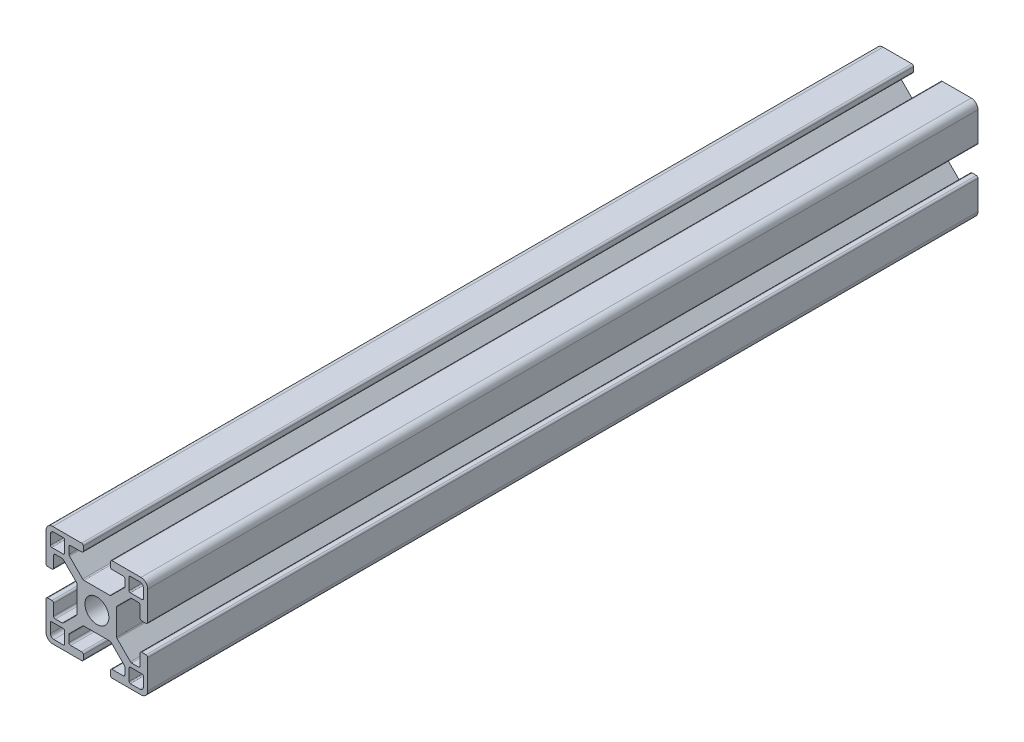
from build123d import *

# Parameters (mm, degrees)
SKETCH1_R           = 3.52998588
BOSS_EXTRUDE1_DEPTH = 122.396160471


with BuildPart() as part:
    # Sketch1 → Boss-Extrude1 (new, symmetric)
    with BuildSketch(Plane.XY):
        with BuildLine():
            Line((14.49994, -4), (13.24247465, -4))
            ThreePointArc((13.24247465, -4), (12.88892126, -4.146446609), (12.74247465, -4.5))
            Line((12.74247465, -4.5), (12.74247465, -7.732519321))
            ThreePointArc((12.74247465, -7.732519321), (12.602449697, -8.097296796), (12.242781236, -8.249967))
            Line((12.242781236, -8.249967), (10.260188032, -8.249967))
            ThreePointArc((10.260188032, -8.249967), (10.068847082, -8.211906919), (9.906636056, -8.103520976))
            Line((9.906636056, -8.103520976), (5.981117769, -4.178002689))
            ThreePointArc((5.981117769, -4.178002689), (5.872731827, -4.015791664), (5.834671745, -3.824450713))
            Line((5.834671745, -3.824450713), (5.834671745, -1.01249595))
            Line((5.834671745, -1.01249595), (5.834671745, 0.88749645))
            Line((5.834671745, 0.88749645), (5.834671745, 3.824450713))
            ThreePointArc((5.834671745, 3.824450713), (5.872731827, 4.015791664), (5.981117769, 4.178002689))
            Line((5.981117769, 4.178002689), (9.906636056, 8.103520976))
            ThreePointArc((9.906636056, 8.103520976), (10.068847082, 8.211906919), (10.260188032, 8.249967))
            Line((10.260188032, 8.249967), (12.242781236, 8.249967))
            ThreePointArc((12.242781236, 8.249967), (12.602449697, 8.097296796), (12.74247465, 7.732519321))
            Line((12.74247465, 7.732519321), (12.74247465, 4.5))
            ThreePointArc((12.74247465, 4.5), (12.88892126, 4.146446609), (13.24247465, 4))
            Line((13.24247465, 4), (14.49994, 4))
            ThreePointArc((14.49994, 4), (14.853493391, 4.146446609), (14.99994, 4.5))
            Line((14.99994, 4.5), (14.99994, 12.999948))
            ThreePointArc((14.99994, 12.999948), (14.414155906, 14.414155906), (12.999948, 14.99994))
            Line((12.999948, 14.99994), (4.5, 14.99994))
            ThreePointArc((4.5, 14.99994), (4.146446609, 14.853493391), (4, 14.49994))
            Line((4, 14.49994), (4, 13.24247465))
            ThreePointArc((4, 13.24247465), (4.146446609, 12.88892126), (4.5, 12.74247465))
            Line((4.5, 12.74247465), (7.732519321, 12.74247465))
            ThreePointArc((7.732519321, 12.74247465), (8.097296796, 12.602449697), (8.249967, 12.242781236))
            Line((8.249967, 12.242781236), (8.249967, 10.260188032))
            ThreePointArc((8.249967, 10.260188032), (8.211906919, 10.068847082), (8.103520976, 9.906636056))
            Line((8.103520976, 9.906636056), (4.178002689, 5.981117769))
            ThreePointArc((4.178002689, 5.981117769), (4.015791664, 5.872731827), (3.824450713, 5.834671745))
            Line((3.824450713, 5.834671745), (0.9499962, 5.834671745))
            Line((0.9499962, 5.834671745), (-0.9499962, 5.834671745))
            Line((-0.9499962, 5.834671745), (-3.824450713, 5.834671745))
            ThreePointArc((-3.824450713, 5.834671745), (-4.015791664, 5.872731827), (-4.178002689, 5.981117769))
            Line((-4.178002689, 5.981117769), (-8.103520976, 9.906636056))
            ThreePointArc((-8.103520976, 9.906636056), (-8.211906919, 10.068847082), (-8.249967, 10.260188032))
            Line((-8.249967, 10.260188032), (-8.249967, 12.242781236))
            ThreePointArc((-8.249967, 12.242781236), (-8.097296796, 12.602449697), (-7.732519321, 12.74247465))
            Line((-7.732519321, 12.74247465), (-4.5, 12.74247465))
            ThreePointArc((-4.5, 12.74247465), (-4.146446609, 12.88892126), (-4, 13.24247465))
            Line((-4, 13.24247465), (-4, 14.49994))
            ThreePointArc((-4, 14.49994), (-4.146446609, 14.853493391), (-4.5, 14.99994))
            Line((-4.5, 14.99994), (-12.999948, 14.99994))
            ThreePointArc((-12.999948, 14.99994), (-14.414155906, 14.414155906), (-14.99994, 12.999948))
            Line((-14.99994, 12.999948), (-14.99994, 4.5))
            ThreePointArc((-14.99994, 4.5), (-14.853493391, 4.146446609), (-14.49994, 4))
            Line((-14.49994, 4), (-13.24247465, 4))
            ThreePointArc((-13.24247465, 4), (-12.88892126, 4.146446609), (-12.74247465, 4.5))
            Line((-12.74247465, 4.5), (-12.74247465, 7.732519321))
            ThreePointArc((-12.74247465, 7.732519321), (-12.602449697, 8.097296796), (-12.242781236, 8.249967))
            Line((-12.242781236, 8.249967), (-10.260188032, 8.249967))
            ThreePointArc((-10.260188032, 8.249967), (-10.068847082, 8.211906919), (-9.906636056, 8.103520976))
            Line((-9.906636056, 8.103520976), (-5.981117769, 4.178002689))
            ThreePointArc((-5.981117769, 4.178002689), (-5.872731827, 4.015791664), (-5.834671745, 3.824450713))
            Line((-5.834671745, 3.824450713), (-5.834671745, 0.88749645))
            Line((-5.834671745, 0.88749645), (-5.834671745, -1.01249595))
            Line((-5.834671745, -1.01249595), (-5.834671745, -3.824450713))
            ThreePointArc((-5.834671745, -3.824450713), (-5.872731827, -4.015791664), (-5.981117769, -4.178002689))
            Line((-5.981117769, -4.178002689), (-9.906636056, -8.103520976))
            ThreePointArc((-9.906636056, -8.103520976), (-10.068847082, -8.211906919), (-10.260188032, -8.249967))
            Line((-10.260188032, -8.249967), (-12.242781236, -8.249967))
            ThreePointArc((-12.242781236, -8.249967), (-12.602449697, -8.097296796), (-12.74247465, -7.732519321))
            Line((-12.74247465, -7.732519321), (-12.74247465, -4.5))
            ThreePointArc((-12.74247465, -4.5), (-12.88892126, -4.146446609), (-13.24247465, -4))
            Line((-13.24247465, -4), (-14.49994, -4))
            ThreePointArc((-14.49994, -4), (-14.853493391, -4.146446609), (-14.99994, -4.5))
            Line((-14.99994, -4.5), (-14.99994, -12.999948))
            ThreePointArc((-14.99994, -12.999948), (-14.414155906, -14.414155906), (-12.999948, -14.99994))
            Line((-12.999948, -14.99994), (-4.5, -14.99994))
            ThreePointArc((-4.5, -14.99994), (-4.146446609, -14.853493391), (-4, -14.49994))
            Line((-4, -14.49994), (-4, -13.24247465))
            ThreePointArc((-4, -13.24247465), (-4.146446609, -12.88892126), (-4.5, -12.74247465))
            Line((-4.5, -12.74247465), (-7.732519321, -12.74247465))
            ThreePointArc((-7.732519321, -12.74247465), (-8.097296796, -12.602449697), (-8.249967, -12.242781236))
            Line((-8.249967, -12.242781236), (-8.249967, -10.260188032))
            ThreePointArc((-8.249967, -10.260188032), (-8.211906919, -10.068847082), (-8.103520976, -9.906636056))
            Line((-8.103520976, -9.906636056), (-4.178002689, -5.981117769))
            ThreePointArc((-4.178002689, -5.981117769), (-4.015791664, -5.872731827), (-3.824450713, -5.834671745))
            Line((-3.824450713, -5.834671745), (-0.9499962, -5.834671745))
            Line((-0.9499962, -5.834671745), (0.9499962, -5.834671745))
            Line((0.9499962, -5.834671745), (3.824450713, -5.834671745))
            ThreePointArc((3.824450713, -5.834671745), (4.015791664, -5.872731827), (4.178002689, -5.981117769))
            Line((4.178002689, -5.981117769), (8.103520976, -9.906636056))
            ThreePointArc((8.103520976, -9.906636056), (8.211906919, -10.068847082), (8.249967, -10.260188032))
            Line((8.249967, -10.260188032), (8.249967, -12.242781236))
            ThreePointArc((8.249967, -12.242781236), (8.097296796, -12.602449697), (7.732519321, -12.74247465))
            Line((7.732519321, -12.74247465), (4.5, -12.74247465))
            ThreePointArc((4.5, -12.74247465), (4.146446609, -12.88892126), (4, -13.24247465))
            Line((4, -13.24247465), (4, -14.49994))
            ThreePointArc((4, -14.49994), (4.146446609, -14.853493391), (4.5, -14.99994))
            Line((4.5, -14.99994), (12.999948, -14.99994))
            ThreePointArc((12.999948, -14.99994), (14.414155906, -14.414155906), (14.99994, -12.999948))
            Line((14.99994, -12.999948), (14.99994, -4.5))
            ThreePointArc((14.99994, -4.5), (14.853493391, -4.146446609), (14.49994, -4))
        make_face()
        Circle(SKETCH1_R, mode=Mode.SUBTRACT)
        with BuildLine():
            Line((-12.6999492, -13.6999452), (-9.880960476, -13.6999452))
            ThreePointArc((-9.880960476, -13.6999452), (-9.61155387, -13.58835333), (-9.499962, -13.318946724))
            Line((-9.499962, -13.318946724), (-9.499962, -9.87996048))
            ThreePointArc((-9.499962, -9.87996048), (-9.611260978, -9.611260978), (-9.87996048, -9.499962))
            Line((-9.87996048, -9.499962), (-13.318946724, -9.499962))
            ThreePointArc((-13.318946724, -9.499962), (-13.58835333, -9.61155387), (-13.6999452, -9.880960476))
            Line((-13.6999452, -9.880960476), (-13.6999452, -12.6999492))
            ThreePointArc((-13.6999452, -12.6999492), (-13.407053153, -13.407053153), (-12.6999492, -13.6999452))
        make_face(mode=Mode.SUBTRACT)
        with BuildLine():
            Line((13.6999452, -12.6999492), (13.6999452, -9.880960476))
            ThreePointArc((13.6999452, -9.880960476), (13.58835333, -9.61155387), (13.318946724, -9.499962))
            Line((13.318946724, -9.499962), (9.87996048, -9.499962))
            ThreePointArc((9.87996048, -9.499962), (9.611260978, -9.611260978), (9.499962, -9.87996048))
            Line((9.499962, -9.87996048), (9.499962, -13.318946724))
            ThreePointArc((9.499962, -13.318946724), (9.61155387, -13.58835333), (9.880960476, -13.6999452))
            Line((9.880960476, -13.6999452), (12.6999492, -13.6999452))
            ThreePointArc((12.6999492, -13.6999452), (13.407053153, -13.407053153), (13.6999452, -12.6999492))
        make_face(mode=Mode.SUBTRACT)
        with BuildLine():
            Line((9.87996048, 9.499962), (13.318946724, 9.499962))
            ThreePointArc((13.318946724, 9.499962), (13.58835333, 9.61155387), (13.6999452, 9.880960476))
            Line((13.6999452, 9.880960476), (13.6999452, 12.6999492))
            ThreePointArc((13.6999452, 12.6999492), (13.407053153, 13.407053153), (12.6999492, 13.6999452))
            Line((12.6999492, 13.6999452), (9.880960476, 13.6999452))
            ThreePointArc((9.880960476, 13.6999452), (9.61155387, 13.58835333), (9.499962, 13.318946724))
            Line((9.499962, 13.318946724), (9.499962, 9.87996048))
            ThreePointArc((9.499962, 9.87996048), (9.611260978, 9.611260978), (9.87996048, 9.499962))
        make_face(mode=Mode.SUBTRACT)
        with BuildLine():
            Line((-13.6999452, 12.6999492), (-13.6999452, 9.880960476))
            ThreePointArc((-13.6999452, 9.880960476), (-13.58835333, 9.61155387), (-13.318946724, 9.499962))
            Line((-13.318946724, 9.499962), (-9.87996048, 9.499962))
            ThreePointArc((-9.87996048, 9.499962), (-9.611260978, 9.611260978), (-9.499962, 9.87996048))
            Line((-9.499962, 9.87996048), (-9.499962, 13.318946724))
            ThreePointArc((-9.499962, 13.318946724), (-9.61155387, 13.58835333), (-9.880960476, 13.6999452))
            Line((-9.880960476, 13.6999452), (-12.6999492, 13.6999452))
            ThreePointArc((-12.6999492, 13.6999452), (-13.407053153, 13.407053153), (-13.6999452, 12.6999492))
        make_face(mode=Mode.SUBTRACT)
    extrude(amount=BOSS_EXTRUDE1_DEPTH, both=True)


solid = part.part
